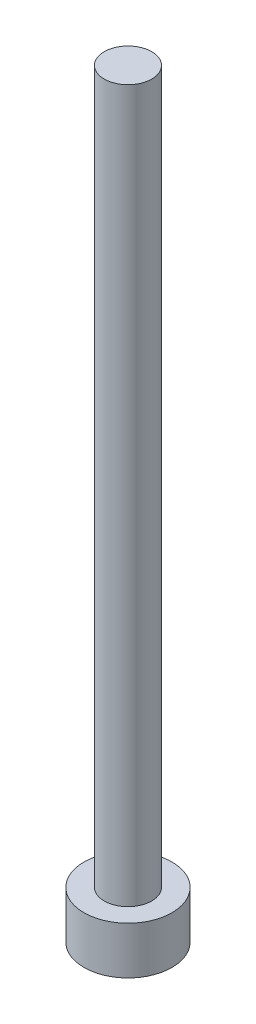
from build123d import *

# Parameters (mm, degrees)
SKETCH1_R           = 2.78
BOSS_EXTRUDE1_DEPTH = 3
SKETCH2_R           = 1.5
BOSS_EXTRUDE2_DEPTH = 45


with BuildPart() as part:
    # Sketch1 → Boss-Extrude1 (new body)
    with BuildSketch(Plane(origin=(0, 0, 0), x_dir=(1, 0, 0), z_dir=(0, 1, 0))):
        with Locations(Location((0, 0, 0), (0, 0, 270))):
            Circle(SKETCH1_R)
    extrude(amount=BOSS_EXTRUDE1_DEPTH)

    # Sketch2 → Boss-Extrude2 (add)
    with BuildSketch(Plane(origin=(0, 3, 0), x_dir=(1, 0, 0), z_dir=(0, 1, 0))):
        with Locations(Location((0, 0, 0), (0, 0, 90))):
            Circle(SKETCH2_R)
    extrude(amount=BOSS_EXTRUDE2_DEPTH)


solid = part.part
